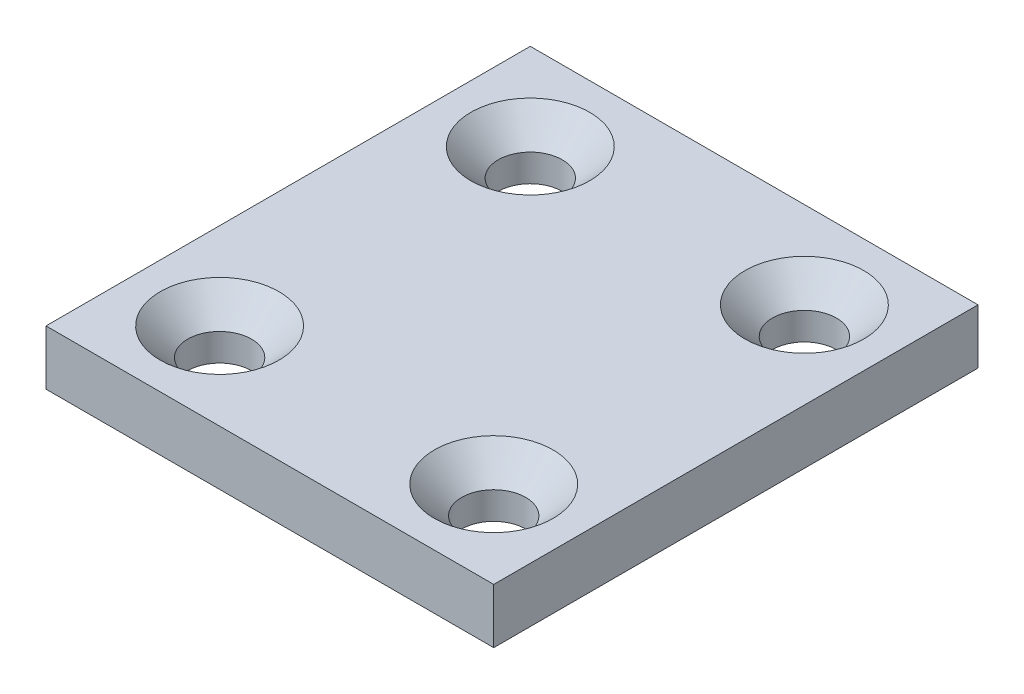
from build123d import *

# Parameters (mm, degrees)
SKETCH_1_W                  = 24.5
SKETCH_1_H                  = 26.5
SKETCH_1_R                  = 1.75
EXTRUDE_1_DEPTH             = 3
HOLE_WIZARD_M3_1_AT_2_COUNT = 2
HOLE_WIZARD_M3_1_AT_2_PITCH = 15
HOLE_WIZARD_M3_1_AT_3_COUNT = 2
HOLE_WIZARD_M3_1_AT_3_PITCH = 22.671568098
HOLE_WIZARD_M3_1_AT_4_COUNT = 2
HOLE_WIZARD_M3_1_AT_4_PITCH = 17


with BuildPart() as part:
    # 草图1 → 凸台-拉伸1 (new body)
    with BuildSketch(Plane(origin=(0, 0, 0), x_dir=(1, 0, 0), z_dir=(0, 1, 0))):
        with Locations((7.5, 8.5)):
            Rectangle(SKETCH_1_W, SKETCH_1_H)
        with Locations(Location((0, 0, 0), (0, 0, 270))):
            Circle(SKETCH_1_R, mode=Mode.SUBTRACT)
        with Locations(Location((15, 0, 0), (0, 0, 270))):
            Circle(SKETCH_1_R, mode=Mode.SUBTRACT)
        with Locations(Location((0, 17, 0), (0, 0, 270))):
            Circle(SKETCH_1_R, mode=Mode.SUBTRACT)
        with Locations(Location((15, 17, 0), (0, 0, 270))):
            Circle(SKETCH_1_R, mode=Mode.SUBTRACT)
    extrude(amount=EXTRUDE_1_DEPTH)

    # 草图5 → M3 平头机械螺钉的锥形沉头孔1 (revolve, cut)
    with BuildSketch(Plane(origin=(0, 3, 0), x_dir=(0, 0, 1), z_dir=(1, 0, 0))):
        Polygon((0, 0), (0, 3), (1.6, 3), (1.6, 1.65), (3.25, 0), align=None)
    hole_wizard_m3_1 = revolve(axis=Axis((0, 9.35, 0), (0, -1, 0)), mode=Mode.SUBTRACT)

    # M3 平头机械螺钉的锥形沉头孔1 at 2: M3 平头机械螺钉的锥形沉头孔1 ×2
    with Locations(*[(i * HOLE_WIZARD_M3_1_AT_2_PITCH, 0, 0) for i in range(1, HOLE_WIZARD_M3_1_AT_2_COUNT)]):
        add(hole_wizard_m3_1, mode=Mode.SUBTRACT)

    # M3 平头机械螺钉的锥形沉头孔1 at 3: M3 平头机械螺钉的锥形沉头孔1 ×2
    with Locations(*[Vector(0.6616216370868463, 0, -0.7498378553650926) * (i * HOLE_WIZARD_M3_1_AT_3_PITCH) for i in range(1, HOLE_WIZARD_M3_1_AT_3_COUNT)]):
        add(hole_wizard_m3_1, mode=Mode.SUBTRACT)

    # M3 平头机械螺钉的锥形沉头孔1 at 4: M3 平头机械螺钉的锥形沉头孔1 ×2
    with Locations(*[(0, 0, -i * HOLE_WIZARD_M3_1_AT_4_PITCH) for i in range(1, HOLE_WIZARD_M3_1_AT_4_COUNT)]):
        add(hole_wizard_m3_1, mode=Mode.SUBTRACT)


solid = part.part
